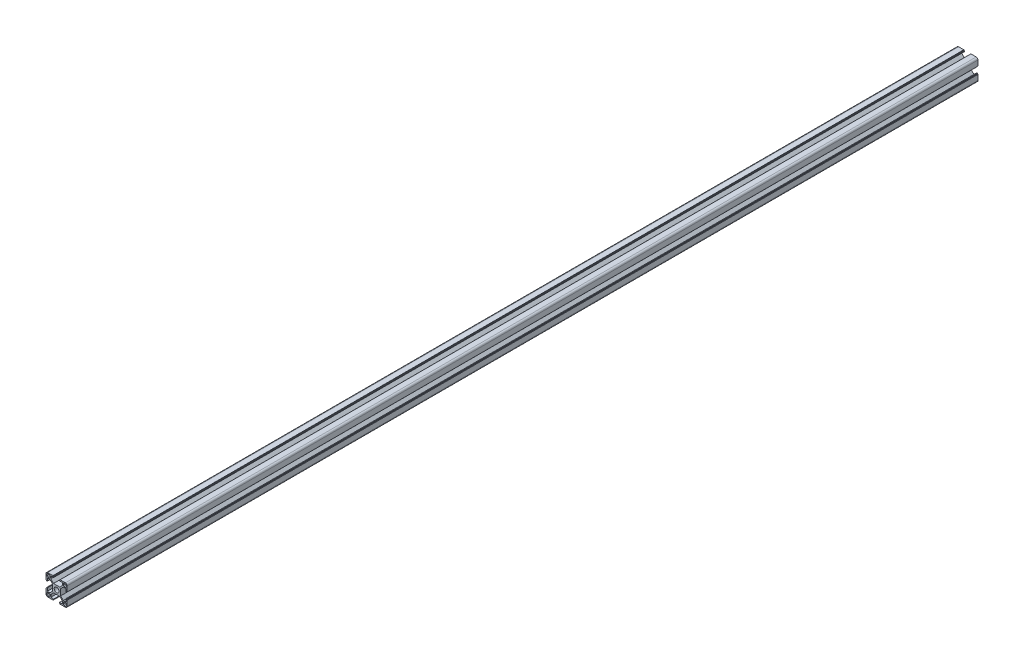
from build123d import *

# Parameters (mm, degrees)
SKETCH1_R      = 3.4
EXTRUDE1_DEPTH = 1290
EXTRUDE2_DEPTH = 1291.174406815


with BuildPart() as part:
    # Sketch1 → Extrude1 (new body)
    with BuildSketch(Plane.XY):
        with BuildLine():
            Line((-5.1, 14.2), (-5.1, 15))
            Line((-5.1, 15), (-12.5, 15))
            ThreePointArc((-12.5, 15), (-14.267766953, 14.267766953), (-15, 12.5))
            Line((-15, 12.5), (-15, 5.1))
            Line((-15, 5.1), (-14.2, 5.1))
            Line((-14.2, 5.1), (-14.2, 4.1))
            Line((-14.2, 4.1), (-13.2, 4.1))
            Line((-13.2, 4.1), (-13.2, 8.25))
            Line((-13.2, 8.25), (-9.522792206, 8.25))
            Line((-9.522792206, 8.25), (-5.7, 4.427207794))
            Line((-5.7, 4.427207794), (-5.7, -4.427207794))
            Line((-5.7, -4.427207794), (-9.522792206, -8.25))
            Line((-9.522792206, -8.25), (-13.2, -8.25))
            Line((-13.2, -8.25), (-13.2, -4.1))
            Line((-13.2, -4.1), (-14.2, -4.1))
            Line((-14.2, -4.1), (-14.2, -5.1))
            Line((-14.2, -5.1), (-15, -5.1))
            Line((-15, -5.1), (-15, -12.5))
            ThreePointArc((-15, -12.5), (-14.267766953, -14.267766953), (-12.5, -15))
            Line((-12.5, -15), (-5.1, -15))
            Line((-5.1, -15), (-5.1, -14.2))
            Line((-5.1, -14.2), (-4.1, -14.2))
            Line((-4.1, -14.2), (-4.1, -13.2))
            Line((-4.1, -13.2), (-8.25, -13.2))
            Line((-8.25, -13.2), (-8.25, -9.522792206))
            Line((-8.25, -9.522792206), (-4.427207794, -5.7))
            Line((-4.427207794, -5.7), (4.427207794, -5.7))
            Line((4.427207794, -5.7), (8.25, -9.522792206))
            Line((8.25, -9.522792206), (8.25, -13.2))
            Line((8.25, -13.2), (4.1, -13.2))
            Line((4.1, -13.2), (4.1, -14.2))
            Line((4.1, -14.2), (5.1, -14.2))
            Line((5.1, -14.2), (5.1, -15))
            Line((5.1, -15), (12.5, -15))
            ThreePointArc((12.5, -15), (14.267766953, -14.267766953), (15, -12.5))
            Line((15, -12.5), (15, -5.1))
            Line((15, -5.1), (14.2, -5.1))
            Line((14.2, -5.1), (14.2, -4.1))
            Line((14.2, -4.1), (13.2, -4.1))
            Line((13.2, -4.1), (13.2, -8.25))
            Line((13.2, -8.25), (9.522792206, -8.25))
            Line((9.522792206, -8.25), (5.7, -4.427207794))
            Line((5.7, -4.427207794), (5.7, 4.427207794))
            Line((5.7, 4.427207794), (9.522792206, 8.25))
            Line((9.522792206, 8.25), (13.2, 8.25))
            Line((13.2, 8.25), (13.2, 4.1))
            Line((13.2, 4.1), (14.2, 4.1))
            Line((14.2, 4.1), (14.2, 5.1))
            Line((14.2, 5.1), (15, 5.1))
            Line((15, 5.1), (15, 12.5))
            ThreePointArc((15, 12.5), (14.267766953, 14.267766953), (12.5, 15))
            Line((12.5, 15), (5.1, 15))
            Line((5.1, 15), (5.1, 14.2))
            Line((5.1, 14.2), (4.1, 14.2))
            Line((4.1, 14.2), (4.1, 13.2))
            Line((4.1, 13.2), (8.25, 13.2))
            Line((8.25, 13.2), (8.25, 9.522792206))
            Line((8.25, 9.522792206), (4.427207794, 5.7))
            Line((4.427207794, 5.7), (-4.427207794, 5.7))
            Line((-4.427207794, 5.7), (-8.25, 9.522792206))
            Line((-8.25, 9.522792206), (-8.25, 13.2))
            Line((-8.25, 13.2), (-4.1, 13.2))
            Line((-4.1, 13.2), (-4.1, 14.2))
            Line((-4.1, 14.2), (-5.1, 14.2))
        make_face()
        with Locations(Location((0, 0, 0), (0, 0, 180))):
            Circle(SKETCH1_R, mode=Mode.SUBTRACT)
    extrude(amount=EXTRUDE1_DEPTH)

    # Sketch2 → Extrude2 (cut, through all)
    with BuildSketch(Plane.XY.offset(1290)):
        with BuildLine():
            Line((13.7, 12.7), (13.7, 10.55))
            ThreePointArc((13.7, 10.55), (13.407106781, 9.842893219), (12.7, 9.55))
            Line((12.7, 9.55), (10.55, 9.55))
            ThreePointArc((10.55, 9.55), (9.842893219, 9.842893219), (9.55, 10.55))
            Line((9.55, 10.55), (9.55, 12.7))
            ThreePointArc((9.55, 12.7), (9.842893219, 13.407106781), (10.55, 13.7))
            Line((10.55, 13.7), (12.7, 13.7))
            ThreePointArc((12.7, 13.7), (13.407106781, 13.407106781), (13.7, 12.7))
        make_face()
        with BuildLine():
            Line((-12.7, 13.7), (-10.55, 13.7))
            ThreePointArc((-10.55, 13.7), (-9.842893219, 13.407106781), (-9.55, 12.7))
            Line((-9.55, 12.7), (-9.55, 10.55))
            ThreePointArc((-9.55, 10.55), (-9.842893219, 9.842893219), (-10.55, 9.55))
            Line((-10.55, 9.55), (-12.7, 9.55))
            ThreePointArc((-12.7, 9.55), (-13.407106781, 9.842893219), (-13.7, 10.55))
            Line((-13.7, 10.55), (-13.7, 12.7))
            ThreePointArc((-13.7, 12.7), (-13.407106781, 13.407106781), (-12.7, 13.7))
        make_face()
        with BuildLine():
            Line((12.7, -13.7), (10.55, -13.7))
            ThreePointArc((10.55, -13.7), (9.842893219, -13.407106781), (9.55, -12.7))
            Line((9.55, -12.7), (9.55, -10.55))
            ThreePointArc((9.55, -10.55), (9.842893219, -9.842893219), (10.55, -9.55))
            Line((10.55, -9.55), (12.7, -9.55))
            ThreePointArc((12.7, -9.55), (13.407106781, -9.842893219), (13.7, -10.55))
            Line((13.7, -10.55), (13.7, -12.7))
            ThreePointArc((13.7, -12.7), (13.407106781, -13.407106781), (12.7, -13.7))
        make_face()
        with BuildLine():
            Line((-13.7, -12.7), (-13.7, -10.55))
            ThreePointArc((-13.7, -10.55), (-13.407106781, -9.842893219), (-12.7, -9.55))
            Line((-12.7, -9.55), (-10.55, -9.55))
            ThreePointArc((-10.55, -9.55), (-9.842893219, -9.842893219), (-9.55, -10.55))
            Line((-9.55, -10.55), (-9.55, -12.7))
            ThreePointArc((-9.55, -12.7), (-9.842893219, -13.407106781), (-10.55, -13.7))
            Line((-10.55, -13.7), (-12.7, -13.7))
            ThreePointArc((-12.7, -13.7), (-13.407106781, -13.407106781), (-13.7, -12.7))
        make_face()
    extrude(amount=-EXTRUDE2_DEPTH, mode=Mode.SUBTRACT)


solid = part.part
